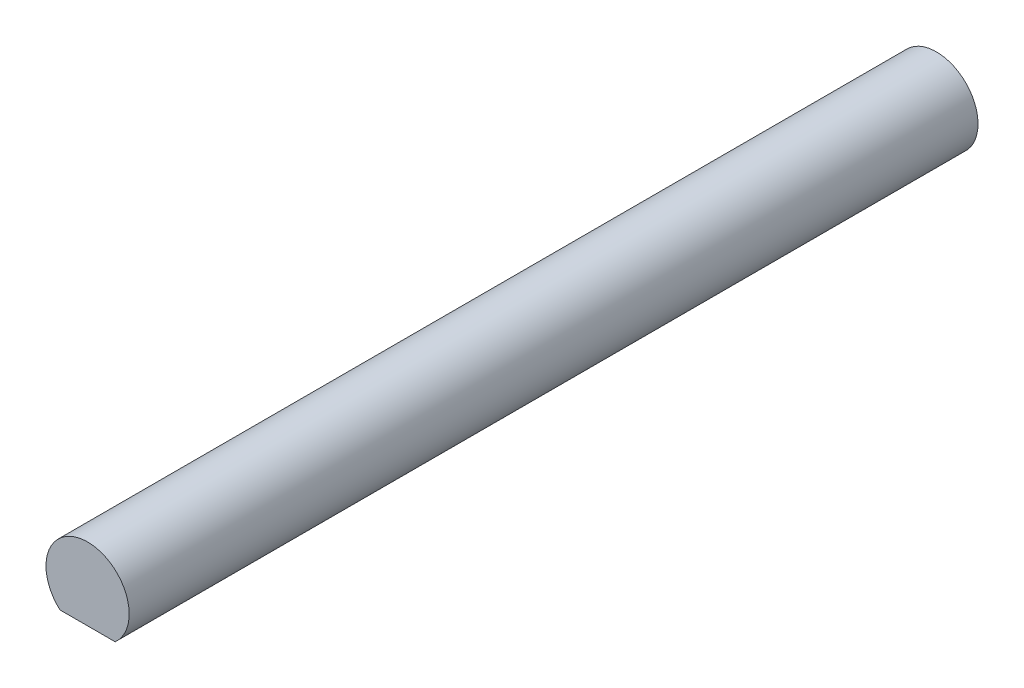
from build123d import *

# Parameters (mm, degrees)
BOSS_EXTRUDE1_DEPTH = 30


with BuildPart() as part:
    # Sketch1 → Boss-Extrude1 (new body)
    with BuildSketch(Plane.XY):
        with BuildLine():
            Line((-0.975141015, -1.1), (0.975141015, -1.1))
            ThreePointArc((0.975141015, -1.1), (0, 1.47), (-0.975141015, -1.1))
        make_face()
    extrude(amount=BOSS_EXTRUDE1_DEPTH)


solid = part.part
